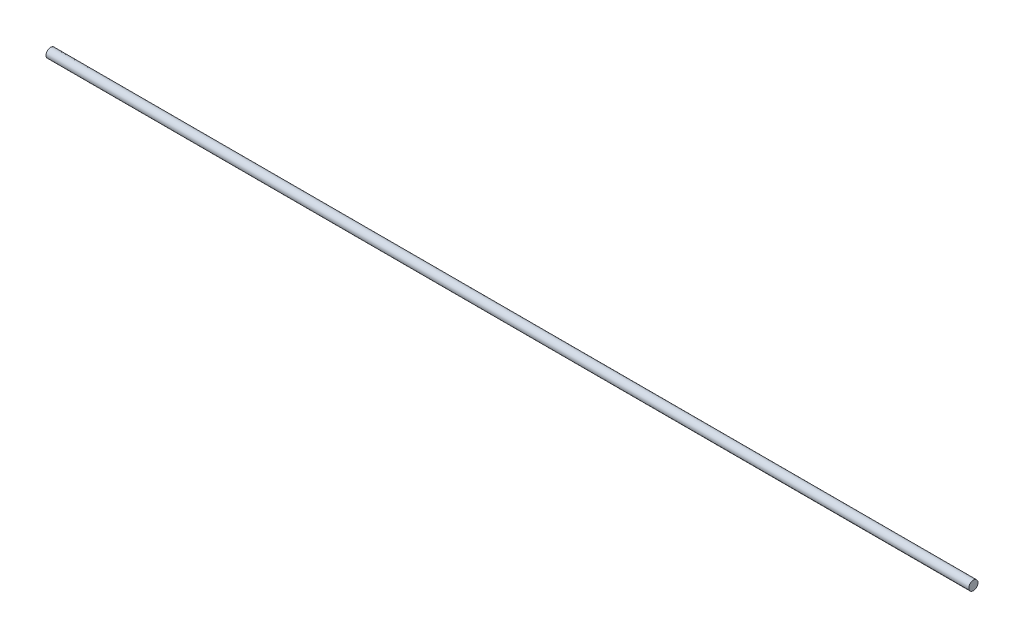
from build123d import *

# Parameters (mm, degrees)
SKETCH1_R           = 0.5
BOSS_EXTRUDE1_DEPTH = 100


with BuildPart() as part:
    # Sketch1 → Boss-Extrude1 (new body)
    with BuildSketch(Plane(origin=(0, 0, 0), x_dir=(0, 0, -1), z_dir=(1, 0, 0))):
        Circle(SKETCH1_R)
    extrude(amount=BOSS_EXTRUDE1_DEPTH)


solid = part.part
